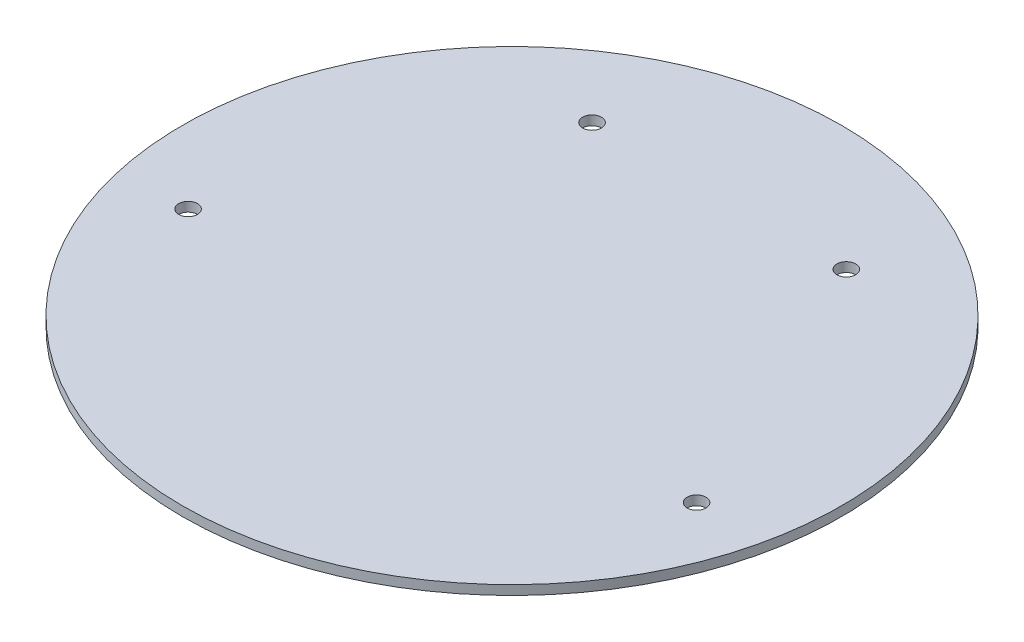
from build123d import *

# Parameters (mm, degrees)
SKETCH1_R           = 35
SKETCH1_R_2         = 1
BOSS_EXTRUDE1_DEPTH = 0.5


with BuildPart() as part:
    # Sketch1 → Boss-Extrude1 (new, symmetric)
    with BuildSketch(Plane(origin=(0, 0, 0), x_dir=(1, 0, 0), z_dir=(0, 1, 0))):
        with Locations(Location((0, 0, 0), (0, 0, 270))):
            Circle(SKETCH1_R)
        with Locations(Location((-27, -7.4, 0), (0, 0, 270))):
            Circle(SKETCH1_R_2, mode=Mode.SUBTRACT)
        with Locations(Location((27, -7.4, 0), (0, 0, 270))):
            Circle(SKETCH1_R_2, mode=Mode.SUBTRACT)
        with Locations(Location((-13.5, 22, 0), (0, 0, 270))):
            Circle(SKETCH1_R_2, mode=Mode.SUBTRACT)
        with Locations(Location((13.5, 22, 0), (0, 0, 270))):
            Circle(SKETCH1_R_2, mode=Mode.SUBTRACT)
    extrude(amount=BOSS_EXTRUDE1_DEPTH, both=True)


solid = part.part
